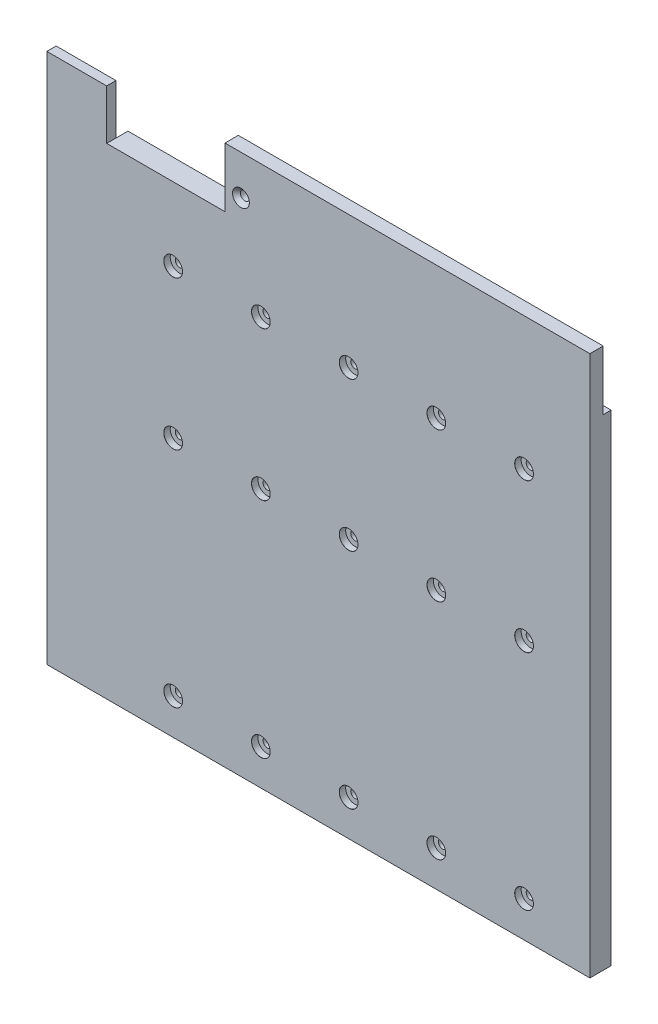
from build123d import *

# Parameters (mm, degrees)
ESQUISSE1_W                                    = 408.5
ESQUISSE1_H                                    = 181
BOSS_EXTRU_1_DEPTH                             = 8
CHAMBRAGE_POUR_VIS_T_TE_RONDE_BOMB_2_COUNT     = 2
CHAMBRAGE_POUR_VIS_T_TE_RONDE_BOMB_2_PITCH     = 56
CHAMBRAGE_POUR_VIS_T_TE_RONDE_BOMB_3_COUNT     = 2
CHAMBRAGE_POUR_VIS_T_TE_RONDE_BOMB_3_PITCH     = 140
R_P_TITION_LIN_AIRE1_COUNT                     = 11
R_P_TITION_LIN_AIRE1_PITCH                     = 33
ESQUISSE4_W                                    = 22.5
ESQUISSE4_H                                    = 4.5
ENL_V_MAT_EXTRU_1_DEPTH                        = 181
ESQUISSE5_W                                    = 22.5
ESQUISSE5_H                                    = 18.725
BOSS_EXTRU_2_DEPTH                             = 3.5
ESQUISSE7_W                                    = 274.5
ESQUISSE7_H                                    = 22.375
BOSS_EXTRU_3_DEPTH                             = 5
FRAISAGE_POUR_VIS_T_TE_FRAIS_E_M31_D           = 3.4
FRAISAGE_POUR_VIS_T_TE_FRAIS_E_M31_CSINK_D     = 6.3
FRAISAGE_POUR_VIS_T_TE_FRAIS_E_M31_CSINK_ANGLE = 90
ESQUISSE10_W                                   = 205.38975882
ESQUISSE10_H                                   = 206.796147943
ENL_V_MAT_EXTRU_2_DEPTH                        = 10


with BuildPart() as part:
    # Esquisse1 → Boss.-Extru.1 (new body)
    with BuildSketch(Plane.XY):
        Rectangle(ESQUISSE1_W, ESQUISSE1_H)
    extrude(amount=BOSS_EXTRU_1_DEPTH)

    # Esquisse3 → Chambrage pour vis à tête ronde bombée M31 (revolve, cut)
    with BuildSketch(Plane(origin=(-156.75, 63, 8), x_dir=(0, -1, 0), z_dir=(1, 0, 0))):
        Polygon((0, 0), (0, 8), (1.6, 8), (1.6, 2.4), (3.5, 2.4), (3.5, 0.025), (3.525, 0), align=None)
    chambrage_pour_vis_t_te_ronde_bomb_e_m = revolve(axis=Axis((-156.75, 63, 14.35), (0, 0, -1)), mode=Mode.SUBTRACT)

    # Chambrage pour vis _ t_te ronde bomb 2: Chambrage pour vis à tête ronde bombée M31 ×2
    with Locations(*[(0, -i * CHAMBRAGE_POUR_VIS_T_TE_RONDE_BOMB_2_PITCH, 0) for i in range(1, CHAMBRAGE_POUR_VIS_T_TE_RONDE_BOMB_2_COUNT)]):
        add(chambrage_pour_vis_t_te_ronde_bomb_e_m, mode=Mode.SUBTRACT)

    # Chambrage pour vis _ t_te ronde bomb 3: Chambrage pour vis à tête ronde bombée M31 ×2
    with Locations(*[(0, -i * CHAMBRAGE_POUR_VIS_T_TE_RONDE_BOMB_3_PITCH, 0) for i in range(1, CHAMBRAGE_POUR_VIS_T_TE_RONDE_BOMB_3_COUNT)]):
        add(chambrage_pour_vis_t_te_ronde_bomb_e_m, mode=Mode.SUBTRACT)

    # Répétition linéaire1: Chambrage pour vis à tête ronde bombée M31 ×11
    with Locations(*[(i * R_P_TITION_LIN_AIRE1_PITCH, 0, 0) for i in range(1, R_P_TITION_LIN_AIRE1_COUNT)]):
        add(chambrage_pour_vis_t_te_ronde_bomb_e_m, mode=Mode.SUBTRACT)

    # Répétition linéaire1 copy 1 sketch → Répétition linéaire1 copy 1 (revolve, cut)
    with BuildSketch(Plane(origin=(-123.75, 7, 8), x_dir=(0, -1, 0), z_dir=(1, 0, 0))):
        Polygon((0, 0), (0, 8), (1.6, 8), (1.6, 2.4), (3.5, 2.4), (3.5, 0.025), (3.525, 0), align=None)
    revolve(axis=Axis((-123.75, 7, 14.35), (0, 0, -1)), mode=Mode.SUBTRACT)

    # Répétition linéaire1 copy 2 sketch → Répétition linéaire1 copy 2 (revolve, cut)
    with BuildSketch(Plane(origin=(-90.75, 7, 8), x_dir=(0, -1, 0), z_dir=(1, 0, 0))):
        Polygon((0, 0), (0, 8), (1.6, 8), (1.6, 2.4), (3.5, 2.4), (3.5, 0.025), (3.525, 0), align=None)
    revolve(axis=Axis((-90.75, 7, 14.35), (0, 0, -1)), mode=Mode.SUBTRACT)

    # Répétition linéaire1 copy 3 sketch → Répétition linéaire1 copy 3 (revolve, cut)
    with BuildSketch(Plane(origin=(-57.75, 7, 8), x_dir=(0, -1, 0), z_dir=(1, 0, 0))):
        Polygon((0, 0), (0, 8), (1.6, 8), (1.6, 2.4), (3.5, 2.4), (3.5, 0.025), (3.525, 0), align=None)
    revolve(axis=Axis((-57.75, 7, 14.35), (0, 0, -1)), mode=Mode.SUBTRACT)

    # Répétition linéaire1 copy 4 sketch → Répétition linéaire1 copy 4 (revolve, cut)
    with BuildSketch(Plane(origin=(-24.75, 7, 8), x_dir=(0, -1, 0), z_dir=(1, 0, 0))):
        Polygon((0, 0), (0, 8), (1.6, 8), (1.6, 2.4), (3.5, 2.4), (3.5, 0.025), (3.525, 0), align=None)
    revolve(axis=Axis((-24.75, 7, 14.35), (0, 0, -1)), mode=Mode.SUBTRACT)

    # Répétition linéaire1 copy 5 sketch → Répétition linéaire1 copy 5 (revolve, cut)
    with BuildSketch(Plane(origin=(8.25, 7, 8), x_dir=(0, -1, 0), z_dir=(1, 0, 0))):
        Polygon((0, 0), (0, 8), (1.6, 8), (1.6, 2.4), (3.5, 2.4), (3.5, 0.025), (3.525, 0), align=None)
    revolve(axis=Axis((8.25, 7, 14.35), (0, 0, -1)), mode=Mode.SUBTRACT)

    # Répétition linéaire1 copy 6 sketch → Répétition linéaire1 copy 6 (revolve, cut)
    with BuildSketch(Plane(origin=(41.25, 7, 8), x_dir=(0, -1, 0), z_dir=(1, 0, 0))):
        Polygon((0, 0), (0, 8), (1.6, 8), (1.6, 2.4), (3.5, 2.4), (3.5, 0.025), (3.525, 0), align=None)
    revolve(axis=Axis((41.25, 7, 14.35), (0, 0, -1)), mode=Mode.SUBTRACT)

    # Répétition linéaire1 copy 7 sketch → Répétition linéaire1 copy 7 (revolve, cut)
    with BuildSketch(Plane(origin=(74.25, 7, 8), x_dir=(0, -1, 0), z_dir=(1, 0, 0))):
        Polygon((0, 0), (0, 8), (1.6, 8), (1.6, 2.4), (3.5, 2.4), (3.5, 0.025), (3.525, 0), align=None)
    revolve(axis=Axis((74.25, 7, 14.35), (0, 0, -1)), mode=Mode.SUBTRACT)

    # Répétition linéaire1 copy 8 sketch → Répétition linéaire1 copy 8 (revolve, cut)
    with BuildSketch(Plane(origin=(107.25, 7, 8), x_dir=(0, -1, 0), z_dir=(1, 0, 0))):
        Polygon((0, 0), (0, 8), (1.6, 8), (1.6, 2.4), (3.5, 2.4), (3.5, 0.025), (3.525, 0), align=None)
    revolve(axis=Axis((107.25, 7, 14.35), (0, 0, -1)), mode=Mode.SUBTRACT)

    # Répétition linéaire1 copy 9 sketch → Répétition linéaire1 copy 9 (revolve, cut)
    with BuildSketch(Plane(origin=(140.25, 7, 8), x_dir=(0, -1, 0), z_dir=(1, 0, 0))):
        Polygon((0, 0), (0, 8), (1.6, 8), (1.6, 2.4), (3.5, 2.4), (3.5, 0.025), (3.525, 0), align=None)
    revolve(axis=Axis((140.25, 7, 14.35), (0, 0, -1)), mode=Mode.SUBTRACT)

    # Répétition linéaire1 copy 10 sketch → Répétition linéaire1 copy 10 (revolve, cut)
    with BuildSketch(Plane(origin=(173.25, 7, 8), x_dir=(0, -1, 0), z_dir=(1, 0, 0))):
        Polygon((0, 0), (0, 8), (1.6, 8), (1.6, 2.4), (3.5, 2.4), (3.5, 0.025), (3.525, 0), align=None)
    revolve(axis=Axis((173.25, 7, 14.35), (0, 0, -1)), mode=Mode.SUBTRACT)

    # Répétition linéaire1 copy 11 sketch → Répétition linéaire1 copy 11 (revolve, cut)
    with BuildSketch(Plane(origin=(-123.75, -77, 8), x_dir=(0, -1, 0), z_dir=(1, 0, 0))):
        Polygon((0, 0), (0, 8), (1.6, 8), (1.6, 2.4), (3.5, 2.4), (3.5, 0.025), (3.525, 0), align=None)
    revolve(axis=Axis((-123.75, -77, 14.35), (0, 0, -1)), mode=Mode.SUBTRACT)

    # Répétition linéaire1 copy 12 sketch → Répétition linéaire1 copy 12 (revolve, cut)
    with BuildSketch(Plane(origin=(-90.75, -77, 8), x_dir=(0, -1, 0), z_dir=(1, 0, 0))):
        Polygon((0, 0), (0, 8), (1.6, 8), (1.6, 2.4), (3.5, 2.4), (3.5, 0.025), (3.525, 0), align=None)
    revolve(axis=Axis((-90.75, -77, 14.35), (0, 0, -1)), mode=Mode.SUBTRACT)

    # Répétition linéaire1 copy 13 sketch → Répétition linéaire1 copy 13 (revolve, cut)
    with BuildSketch(Plane(origin=(-57.75, -77, 8), x_dir=(0, -1, 0), z_dir=(1, 0, 0))):
        Polygon((0, 0), (0, 8), (1.6, 8), (1.6, 2.4), (3.5, 2.4), (3.5, 0.025), (3.525, 0), align=None)
    revolve(axis=Axis((-57.75, -77, 14.35), (0, 0, -1)), mode=Mode.SUBTRACT)

    # Répétition linéaire1 copy 14 sketch → Répétition linéaire1 copy 14 (revolve, cut)
    with BuildSketch(Plane(origin=(-24.75, -77, 8), x_dir=(0, -1, 0), z_dir=(1, 0, 0))):
        Polygon((0, 0), (0, 8), (1.6, 8), (1.6, 2.4), (3.5, 2.4), (3.5, 0.025), (3.525, 0), align=None)
    revolve(axis=Axis((-24.75, -77, 14.35), (0, 0, -1)), mode=Mode.SUBTRACT)

    # Répétition linéaire1 copy 15 sketch → Répétition linéaire1 copy 15 (revolve, cut)
    with BuildSketch(Plane(origin=(8.25, -77, 8), x_dir=(0, -1, 0), z_dir=(1, 0, 0))):
        Polygon((0, 0), (0, 8), (1.6, 8), (1.6, 2.4), (3.5, 2.4), (3.5, 0.025), (3.525, 0), align=None)
    revolve(axis=Axis((8.25, -77, 14.35), (0, 0, -1)), mode=Mode.SUBTRACT)

    # Répétition linéaire1 copy 16 sketch → Répétition linéaire1 copy 16 (revolve, cut)
    with BuildSketch(Plane(origin=(41.25, -77, 8), x_dir=(0, -1, 0), z_dir=(1, 0, 0))):
        Polygon((0, 0), (0, 8), (1.6, 8), (1.6, 2.4), (3.5, 2.4), (3.5, 0.025), (3.525, 0), align=None)
    revolve(axis=Axis((41.25, -77, 14.35), (0, 0, -1)), mode=Mode.SUBTRACT)

    # Répétition linéaire1 copy 17 sketch → Répétition linéaire1 copy 17 (revolve, cut)
    with BuildSketch(Plane(origin=(74.25, -77, 8), x_dir=(0, -1, 0), z_dir=(1, 0, 0))):
        Polygon((0, 0), (0, 8), (1.6, 8), (1.6, 2.4), (3.5, 2.4), (3.5, 0.025), (3.525, 0), align=None)
    revolve(axis=Axis((74.25, -77, 14.35), (0, 0, -1)), mode=Mode.SUBTRACT)

    # Répétition linéaire1 copy 18 sketch → Répétition linéaire1 copy 18 (revolve, cut)
    with BuildSketch(Plane(origin=(107.25, -77, 8), x_dir=(0, -1, 0), z_dir=(1, 0, 0))):
        Polygon((0, 0), (0, 8), (1.6, 8), (1.6, 2.4), (3.5, 2.4), (3.5, 0.025), (3.525, 0), align=None)
    revolve(axis=Axis((107.25, -77, 14.35), (0, 0, -1)), mode=Mode.SUBTRACT)

    # Répétition linéaire1 copy 19 sketch → Répétition linéaire1 copy 19 (revolve, cut)
    with BuildSketch(Plane(origin=(140.25, -77, 8), x_dir=(0, -1, 0), z_dir=(1, 0, 0))):
        Polygon((0, 0), (0, 8), (1.6, 8), (1.6, 2.4), (3.5, 2.4), (3.5, 0.025), (3.525, 0), align=None)
    revolve(axis=Axis((140.25, -77, 14.35), (0, 0, -1)), mode=Mode.SUBTRACT)

    # Répétition linéaire1 copy 20 sketch → Répétition linéaire1 copy 20 (revolve, cut)
    with BuildSketch(Plane(origin=(173.25, -77, 8), x_dir=(0, -1, 0), z_dir=(1, 0, 0))):
        Polygon((0, 0), (0, 8), (1.6, 8), (1.6, 2.4), (3.5, 2.4), (3.5, 0.025), (3.525, 0), align=None)
    revolve(axis=Axis((173.25, -77, 14.35), (0, 0, -1)), mode=Mode.SUBTRACT)

    # Esquisse4 → Enlèv. mat.-Extru.1 (cut)
    with BuildSketch(Plane(origin=(0, 90.5, 0), x_dir=(1, 0, 0), z_dir=(0, 1, 0))):
        with Locations((-193, -2.25)):
            Rectangle(ESQUISSE4_W, ESQUISSE4_H)
        with Locations((193, -2.25)):
            Rectangle(ESQUISSE4_W, ESQUISSE4_H)
    extrude(amount=-ENL_V_MAT_EXTRU_1_DEPTH, mode=Mode.SUBTRACT)

    # Esquisse5 → Boss.-Extru.2 (add)
    with BuildSketch(Plane.XY.offset(8)):
        with Locations((-193, 99.8625)):
            Rectangle(ESQUISSE5_W, ESQUISSE5_H)
    boss_extru_2 = extrude(amount=-BOSS_EXTRU_2_DEPTH)

    # Symétrie1: Boss.-Extru.2 across plane
    add(boss_extru_2.mirror(Plane(origin=(0, 0, 0), x_dir=(0, 0, 1), z_dir=(1, 0, 0))))

    # Esquisse7 → Boss.-Extru.3 (add)
    with BuildSketch(Plane.XY.offset(8)):
        with Locations((0, 101.6875)):
            Rectangle(ESQUISSE7_W, ESQUISSE7_H)
    extrude(amount=-BOSS_EXTRU_3_DEPTH)

    # Fraisage pour vis à tête fraisée M31 (through all)
    with Locations(Plane.XY.offset(8)):
        with Locations((-131.25, 98), (131.25, 98)):
            CounterSinkHole(FRAISAGE_POUR_VIS_T_TE_FRAIS_E_M31_D / 2, FRAISAGE_POUR_VIS_T_TE_FRAIS_E_M31_CSINK_D / 2, counter_sink_angle=FRAISAGE_POUR_VIS_T_TE_FRAIS_E_M31_CSINK_ANGLE)

    # Esquisse10 → Enlèv. mat.-Extru.2 (cut)
    with BuildSketch(Plane(origin=(0, 0, 0), x_dir=(-1, 0, 0), z_dir=(0, 0, -1))):
        with Locations((-102.69487941, 12.898073972)):
            Rectangle(ESQUISSE10_W, ESQUISSE10_H)
    extrude(amount=-ENL_V_MAT_EXTRU_2_DEPTH, mode=Mode.SUBTRACT)


solid = part.part
